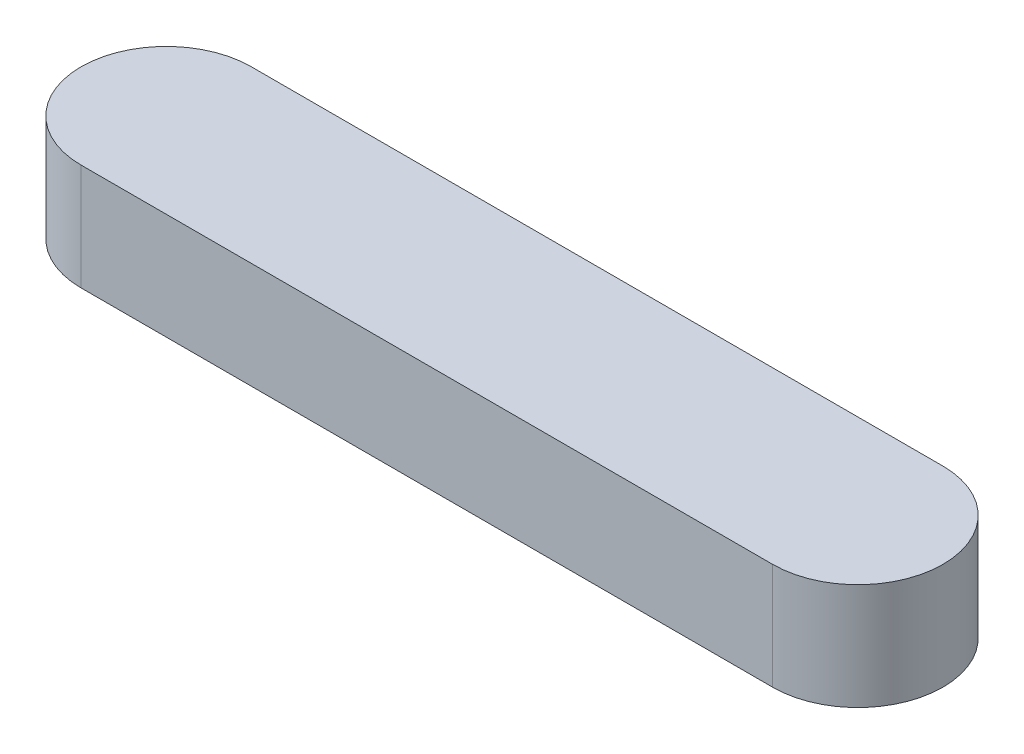
from build123d import *

# Parameters (mm, degrees)
BOSS_EXTRU_1_DEPTH = 10


with BuildPart() as part:
    # Esquisse1 → Boss.-Extru.1 (new body)
    with BuildSketch(Plane(origin=(0, 0, 0), x_dir=(1, 0, 0), z_dir=(0, 1, 0))):
        with BuildLine():
            Line((-32.5, 8), (32.5, 8))
            ThreePointArc((32.5, 8), (40.5, 0), (32.5, -8))
            Line((32.5, -8), (-32.5, -8))
            ThreePointArc((-32.5, -8), (-40.5, 0), (-32.5, 8))
        make_face()
    extrude(amount=BOSS_EXTRU_1_DEPTH)


solid = part.part
